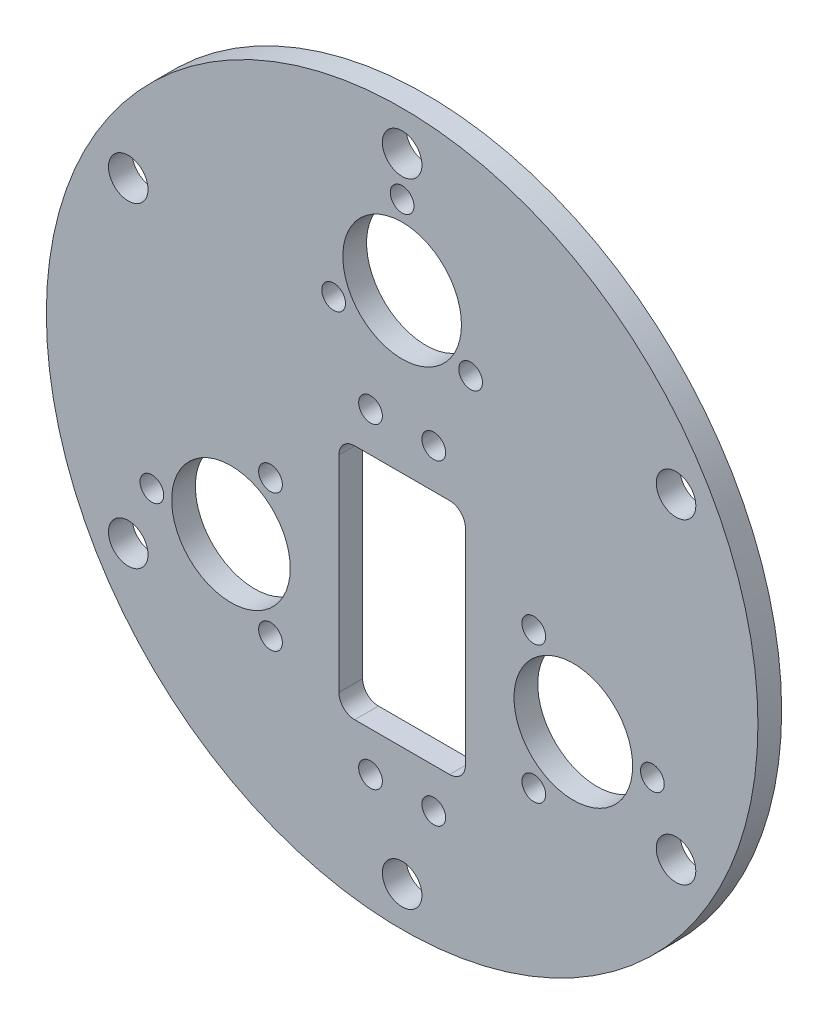
from build123d import *

# Parameters (mm, degrees)
SKETCH1_R           = 4.5
SKETCH1_R_2         = 0.75
BOSS_EXTRUDE1_DEPTH = 0.3
SKETCH2_R           = 0.25
CUT_EXTRUDE1_DEPTH  = 0.3
SKETCH3_W           = 1.6
SKETCH3_H           = 3
CUT_EXTRUDE2_DEPTH  = 0.3
FILLET1_R           = 0.2
SKETCH4_R           = 0.15
CUT_EXTRUDE3_DEPTH  = 0.3
CIRPATTERN1_COUNT   = 3
SKETCH5_R           = 0.15
CUT_EXTRUDE4_DEPTH  = 0.3
CIRPATTERN3_COUNT   = 3
SKETCH6_R           = 0.15
CUT_EXTRUDE5_DEPTH  = 0.3
CIRPATTERN4_COUNT   = 3
SKETCH7_R           = 0.15
CUT_EXTRUDE8_DEPTH  = 0.3


with BuildPart() as part:
    # Sketch1 → Boss-Extrude1 (new body)
    with BuildSketch(Plane.XY):
        Circle(SKETCH1_R)
        with Locations((0, 2.5)):
            Circle(SKETCH1_R_2, mode=Mode.SUBTRACT)
        with Locations((2.165063509, -1.25)):
            Circle(SKETCH1_R_2, mode=Mode.SUBTRACT)
        with Locations((-2.165063509, -1.25)):
            Circle(SKETCH1_R_2, mode=Mode.SUBTRACT)
    extrude(amount=BOSS_EXTRUDE1_DEPTH)

    # Sketch2 → Cut-Extrude1 (cut)
    with BuildSketch(Plane.XY.offset(0.3)):
        with Locations((0, -4)):
            Circle(SKETCH2_R)
        with Locations((-3.464101615, -2)):
            Circle(SKETCH2_R)
        with Locations((-3.464101615, 2)):
            Circle(SKETCH2_R)
        with Locations((0, 4)):
            Circle(SKETCH2_R)
        with Locations((3.464101615, 2)):
            Circle(SKETCH2_R)
        with Locations((3.464101615, -2)):
            Circle(SKETCH2_R)
    extrude(amount=-CUT_EXTRUDE1_DEPTH, mode=Mode.SUBTRACT)

    # Sketch3 → Cut-Extrude2 (cut)
    with BuildSketch(Plane.XY.offset(0.3)):
        with Locations((0, -1)):
            Rectangle(SKETCH3_W, SKETCH3_H)
    extrude(amount=-CUT_EXTRUDE2_DEPTH, mode=Mode.SUBTRACT)

    # Fillet1
    fillet1_edges = [part.edges().sort_by_distance(p)[0] for p in [
        (-0.8, 0.5, 0.15),
        (0.8, 0.5, 0.15),
        (0.8, -2.5, 0.15),
        (-0.8, -2.5, 0.15),
    ]]
    fillet(fillet1_edges, radius=FILLET1_R)

    # Sketch4 → Cut-Extrude3 (cut)
    with BuildSketch(Plane.XY.offset(0.3)):
        with Locations((0, 3.5)):
            Circle(SKETCH4_R)
    cut_extrude3 = extrude(amount=-CUT_EXTRUDE3_DEPTH, mode=Mode.SUBTRACT)

    # CirPattern1: Cut-Extrude3 ×3 about axis
    cirpattern1_axis = Axis((0, 2.5, 0), (0, 0, 1))
    for i in range(1, CIRPATTERN1_COUNT):
        add(cut_extrude3.rotate(cirpattern1_axis, i * 360 / CIRPATTERN1_COUNT), mode=Mode.SUBTRACT)

    # Sketch5 → Cut-Extrude4 (cut)
    with BuildSketch(Plane.XY.offset(0.3)):
        with Locations((3.165063509, -1.25)):
            Circle(SKETCH5_R)
    cut_extrude4 = extrude(amount=-CUT_EXTRUDE4_DEPTH, mode=Mode.SUBTRACT)

    # CirPattern3: Cut-Extrude4 ×3 about axis
    cirpattern3_axis = Axis((2.165063509, -1.25, 0), (0, 0, 1))
    for i in range(1, CIRPATTERN3_COUNT):
        add(cut_extrude4.rotate(cirpattern3_axis, i * 360 / CIRPATTERN3_COUNT), mode=Mode.SUBTRACT)

    # Sketch6 → Cut-Extrude5 (cut)
    with BuildSketch(Plane.XY.offset(0.3)):
        with Locations((-3.165063509, -1.25)):
            Circle(SKETCH6_R)
    cut_extrude5 = extrude(amount=-CUT_EXTRUDE5_DEPTH, mode=Mode.SUBTRACT)

    # CirPattern4: Cut-Extrude5 ×3 about axis
    cirpattern4_axis = Axis((-2.165063509, -1.25, 0), (0, 0, 1))
    for i in range(1, CIRPATTERN4_COUNT):
        add(cut_extrude5.rotate(cirpattern4_axis, i * 360 / CIRPATTERN4_COUNT), mode=Mode.SUBTRACT)

    # Sketch7 → Cut-Extrude8 (cut)
    with BuildSketch(Plane.XY.offset(0.3)):
        with Locations((0.4, -3)):
            Circle(SKETCH7_R)
        with Locations((-0.4, -3)):
            Circle(SKETCH7_R)
        with Locations((0.4, 1)):
            Circle(SKETCH7_R)
        with Locations((-0.4, 1)):
            Circle(SKETCH7_R)
    extrude(amount=-CUT_EXTRUDE8_DEPTH, mode=Mode.SUBTRACT)


solid = part.part
